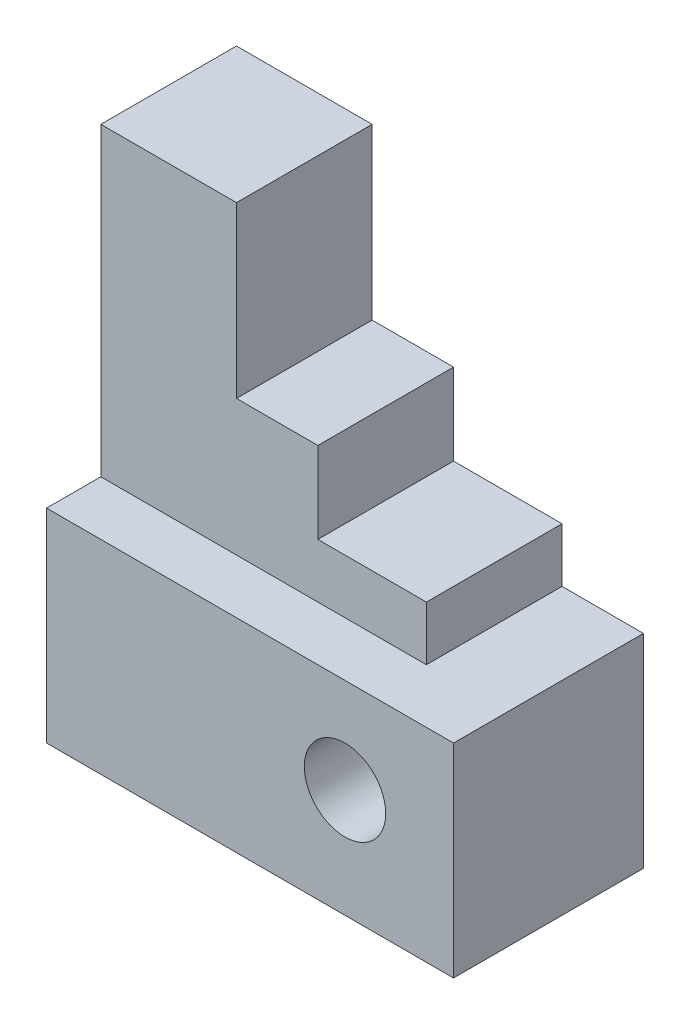
from build123d import *

# Parameters (mm, degrees)
SKETCH1_W           = 60
SKETCH1_H           = 30
SKETCH1_R           = 6
BOSS_EXTRUDE1_DEPTH = 28
BOSS_EXTRUDE2_DEPTH = 20


with BuildPart() as part:
    # Sketch1 → Boss-Extrude1 (new body)
    with BuildSketch(Plane.XY):
        with Locations((30, 15)):
            Rectangle(SKETCH1_W, SKETCH1_H)
        with Locations((44, 16)):
            Circle(SKETCH1_R, mode=Mode.SUBTRACT)
    extrude(amount=BOSS_EXTRUDE1_DEPTH)

    # Sketch2 → Boss-Extrude2 (add)
    with BuildSketch(Plane.XY):
        Polygon((0, 30), (0, 75), (20, 75), (20, 50), (32, 50), (32, 38), (48, 38), (48, 30), align=None)
    extrude(amount=BOSS_EXTRUDE2_DEPTH)


solid = part.part
